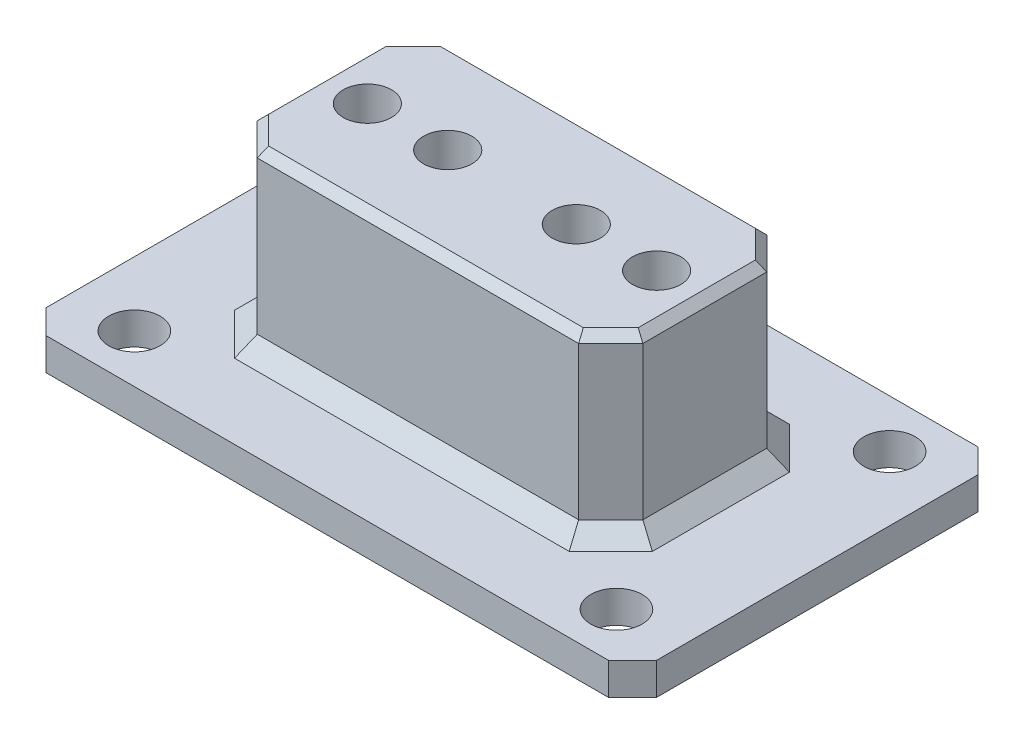
from build123d import *

# Parameters (mm, degrees)
SKETCH1_W           = 38
SKETCH1_H           = 23
SKETCH1_R           = 1.6
BOSS_EXTRUDE1_DEPTH = 2
SKETCH2_W           = 24
SKETCH2_H           = 11.708497378
SKETCH2_R           = 1.5
BOSS_EXTRUDE2_DEPTH = 11
CHAMFER1_SIZE       = 2
CHAMFER2_SIZE       = 1
CHAMFER3_SIZE       = 1.5
CHAMFER4_SIZE       = 0.5


with BuildPart() as part:
    # Sketch1 → Boss-Extrude1 (new body)
    with BuildSketch(Plane(origin=(0, 0, 0), x_dir=(1, 0, 0), z_dir=(0, 1, 0))):
        Rectangle(SKETCH1_W, SKETCH1_H)
        with Locations(Location((-15, 8.5, 0), (0, 0, 270))):
            Circle(SKETCH1_R, mode=Mode.SUBTRACT)
        with Locations(Location((15, 8.5, 0), (0, 0, 90))):
            Circle(SKETCH1_R, mode=Mode.SUBTRACT)
        with Locations(Location((15, -8.5, 0), (0, 0, 270))):
            Circle(SKETCH1_R, mode=Mode.SUBTRACT)
        with Locations(Location((-15, -8.5, 0), (0, 0, 90))):
            Circle(SKETCH1_R, mode=Mode.SUBTRACT)
    extrude(amount=BOSS_EXTRUDE1_DEPTH)

    # Sketch2 → Boss-Extrude2 (add)
    with BuildSketch(Plane(origin=(0, 2, 0), x_dir=(1, 0, 0), z_dir=(0, 1, 0))):
        Rectangle(SKETCH2_W, SKETCH2_H)
        with Locations(Location((-9, 0, 0), (0, 0, 270))):
            Circle(SKETCH2_R, mode=Mode.SUBTRACT)
        with Locations(Location((-4, 0, 0), (0, 0, 270))):
            Circle(SKETCH2_R, mode=Mode.SUBTRACT)
        with Locations(Location((4, 0, 0), (0, 0, 90))):
            Circle(SKETCH2_R, mode=Mode.SUBTRACT)
        with Locations(Location((9, 0, 0), (0, 0, 90))):
            Circle(SKETCH2_R, mode=Mode.SUBTRACT)
    extrude(amount=BOSS_EXTRUDE2_DEPTH)

    # Chamfer1
    chamfer1_edges = [part.edges().sort_by_distance(p)[0] for p in [
        (12, 7.5, 5.854248689),
        (12, 7.5, -5.854248689),
        (-12, 7.5, -5.854248689),
        (-12, 7.5, 5.854248689),
    ]]
    chamfer(chamfer1_edges, length=CHAMFER1_SIZE)

    # Chamfer2
    chamfer2_edges = [part.edges().sort_by_distance(p)[0] for p in [
        (0, 2, 5.854248689),
        (-12, 2, 0),
        (0, 2, -5.854248689),
        (12, 2, 0),
        (-11, 2, 4.854248689),
        (-11, 2, -4.854248689),
        (11, 2, -4.854248689),
        (11, 2, 4.854248689),
    ]]
    chamfer(chamfer2_edges, length=CHAMFER2_SIZE)

    # Chamfer3
    chamfer3_edges = [part.edges().sort_by_distance(p)[0] for p in [
        (19, 1, 11.5),
        (-19, 1, 11.5),
        (-19, 1, -11.5),
        (19, 1, -11.5),
    ]]
    chamfer(chamfer3_edges, length=CHAMFER3_SIZE)

    # Chamfer4
    chamfer4_edges = [part.edges().sort_by_distance(p)[0] for p in [
        (0, 13, 5.854248689),
        (-12, 13, 0),
        (12, 13, 0),
        (0, 13, -5.854248689),
        (11, 13, 4.854248689),
        (11, 13, -4.854248689),
        (-11, 13, -4.854248689),
        (-11, 13, 4.854248689),
    ]]
    chamfer(chamfer4_edges, length=CHAMFER4_SIZE)


solid = part.part
